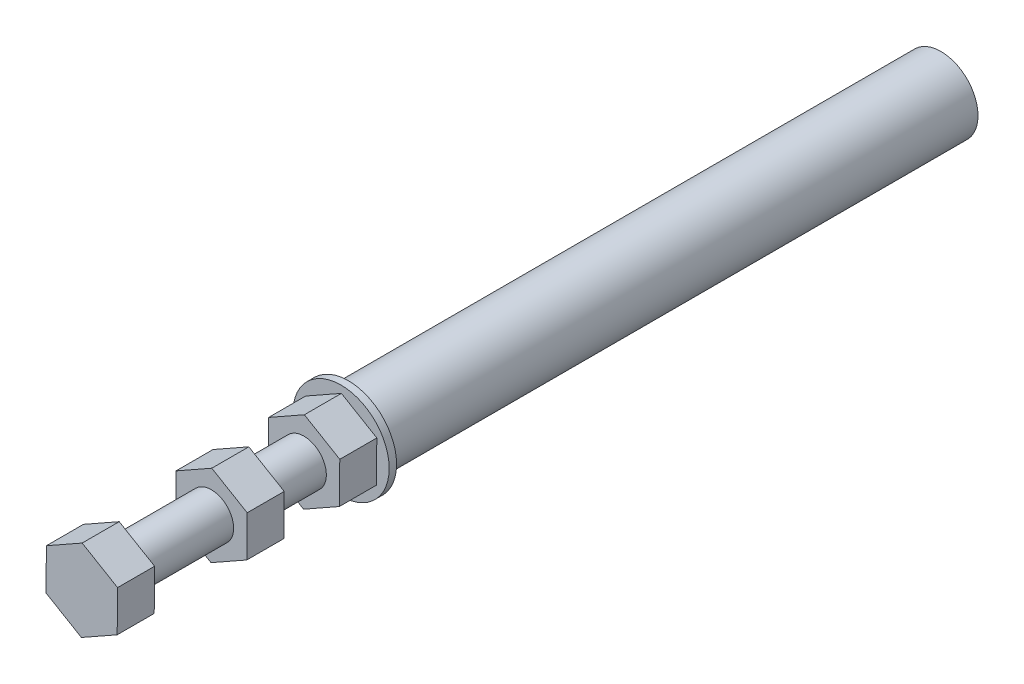
from build123d import *

# Parameters (mm, degrees)
SKETCH1_R           = 5
BOSS_EXTRUDE1_DEPTH = 80
SKETCH2_R           = 6.5
BOSS_EXTRUDE2_DEPTH = 1
BOSS_EXTRUDE5_DEPTH = 5
SKETCH6_R           = 3.019653564
BOSS_EXTRUDE6_DEPTH = 7.5
BOSS_EXTRUDE7_DEPTH = 5
SKETCH8_R           = 3
BOSS_EXTRUDE8_DEPTH = 12.5
BOSS_EXTRUDE9_DEPTH = 5


with BuildPart() as part:
    # Sketch1 → Boss-Extrude1 (new body)
    with BuildSketch(Plane.XY):
        Circle(SKETCH1_R)
    extrude(amount=BOSS_EXTRUDE1_DEPTH)

    # Sketch2 → Boss-Extrude2 (add)
    with BuildSketch(Plane.XY.offset(80)):
        Circle(SKETCH2_R)
    extrude(amount=BOSS_EXTRUDE2_DEPTH)

    # Sketch5 → Boss-Extrude5 (add)
    with BuildSketch(Plane.XY.offset(81)):
        Polygon((4.778851136, -2.820156932), (4.831753114, 2.728528019), (0.052901978, 5.548684951), (-4.778851136, 2.820156932), (-4.831753114, -2.728528019), (-0.052901978, -5.548684951), align=None)
    extrude(amount=BOSS_EXTRUDE5_DEPTH)

    # Sketch6 → Boss-Extrude6 (add)
    with BuildSketch(Plane.XY.offset(86)):
        Circle(SKETCH6_R)
    extrude(amount=BOSS_EXTRUDE6_DEPTH)

    # Sketch7 → Boss-Extrude7 (add)
    with BuildSketch(Plane.XY.offset(93.5)):
        Polygon((4.778851136, -2.820156932), (4.831753114, 2.728528019), (0.052901978, 5.548684951), (-4.778851136, 2.820156932), (-4.831753114, -2.728528019), (-0.052901978, -5.548684951), align=None)
    extrude(amount=BOSS_EXTRUDE7_DEPTH)

    # Sketch8 → Boss-Extrude8 (add)
    with BuildSketch(Plane.XY.offset(98.5)):
        Circle(SKETCH8_R)
    extrude(amount=BOSS_EXTRUDE8_DEPTH)

    # Sketch9 → Boss-Extrude9 (add)
    with BuildSketch(Plane.XY.offset(111)):
        Polygon((4.778851136, -2.820156932), (4.831753114, 2.728528019), (0.052901978, 5.548684951), (-4.778851136, 2.820156932), (-4.831753114, -2.728528019), (-0.052901978, -5.548684951), align=None)
    extrude(amount=BOSS_EXTRUDE9_DEPTH)


solid = part.part
